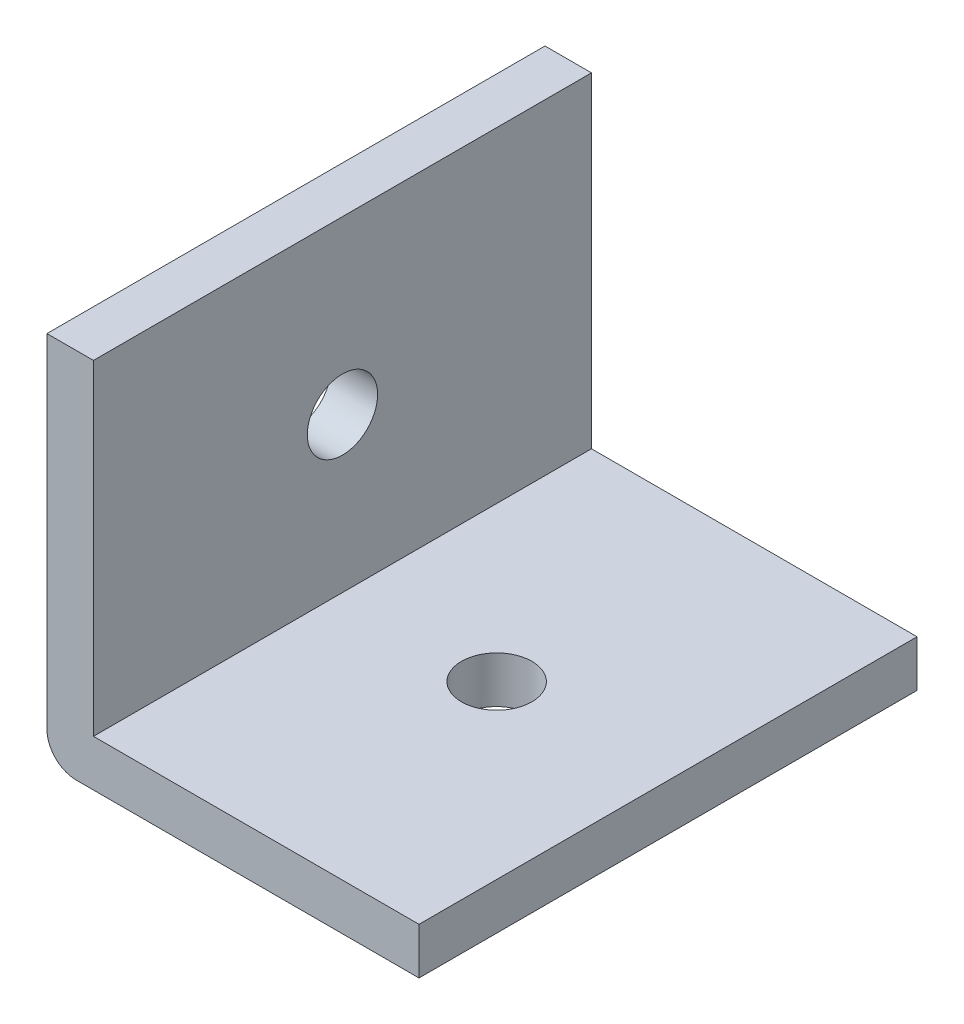
from build123d import *

# Parameters (mm, degrees)
SKETCH1_W                = 12.7
SKETCH1_H                = 17
BOSS_EXTRUDE1_DEPTH      = 1.5875
SKETCH2_W                = 1.5875
SKETCH2_H                = 17
BOSS_EXTRUDE2_DEPTH      = 11.1125
FILLET1_R                = 1
M2_CLEARANCE_HOLE1_D     = 2.4
M2_CLEARANCE_HOLE1_DEPTH = 2
M2_CLEARANCE_HOLE1_TIP   = 0.721032743
M2_CLEARANCE_HOLE2_D     = 2.4
M2_CLEARANCE_HOLE2_DEPTH = 2
M2_CLEARANCE_HOLE2_TIP   = 0.721032743


with BuildPart() as part:
    # Sketch1 → Boss-Extrude1 (new body)
    with BuildSketch(Plane(origin=(0, 0, 0), x_dir=(1, 0, 0), z_dir=(0, 1, 0))):
        with Locations((6.35, -8.5)):
            Rectangle(SKETCH1_W, SKETCH1_H)
    extrude(amount=BOSS_EXTRUDE1_DEPTH)

    # Sketch2 → Boss-Extrude2 (add)
    with BuildSketch(Plane(origin=(0, 1.5875, 0), x_dir=(1, 0, 0), z_dir=(0, 1, 0))):
        with Locations((0.79375, -8.5)):
            Rectangle(SKETCH2_W, SKETCH2_H)
    extrude(amount=BOSS_EXTRUDE2_DEPTH)

    # Fillet1
    fillet1_edges = [part.edges().sort_by_distance(p)[0] for p in [
        (0, 0, 8.5),
    ]]
    fillet(fillet1_edges, radius=FILLET1_R)

    # M2 Clearance Hole1
    with Locations(Plane(origin=(0, 0, 0), x_dir=(-1, 0, 0), z_dir=(0, -1, 0))):
        with Locations((-6.85, -8.5)):
            Hole(M2_CLEARANCE_HOLE1_D / 2, depth=M2_CLEARANCE_HOLE1_DEPTH)
            with Locations((0, 0, -(M2_CLEARANCE_HOLE1_DEPTH + M2_CLEARANCE_HOLE1_TIP / 2))):  # 118° drill point
                Cone(0, M2_CLEARANCE_HOLE1_D / 2, M2_CLEARANCE_HOLE1_TIP, mode=Mode.SUBTRACT)

    # M2 Clearance Hole2
    with Locations(Plane.ZY):
        with Locations((8.5, 6.85)):
            Hole(M2_CLEARANCE_HOLE2_D / 2, depth=M2_CLEARANCE_HOLE2_DEPTH)
            with Locations((0, 0, -(M2_CLEARANCE_HOLE2_DEPTH + M2_CLEARANCE_HOLE2_TIP / 2))):  # 118° drill point
                Cone(0, M2_CLEARANCE_HOLE2_D / 2, M2_CLEARANCE_HOLE2_TIP, mode=Mode.SUBTRACT)


solid = part.part
